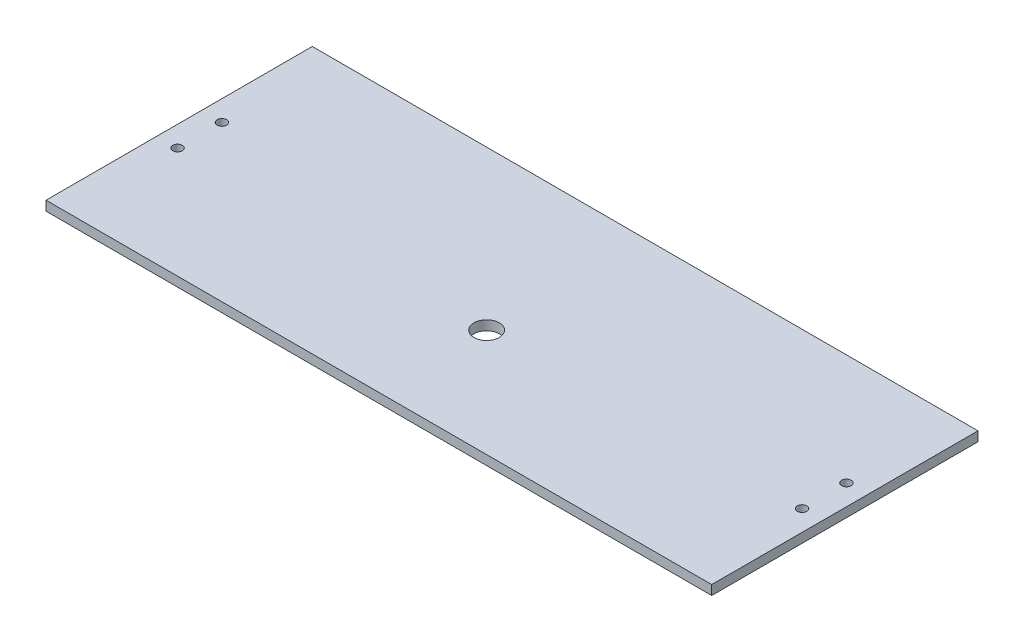
from build123d import *

# Parameters (mm, degrees)
CROQUIS2_W              = 210
CROQUIS2_H              = 84
CROQUIS2_R              = 4
CROQUIS2_R_2            = 1.5
SALIENTE_EXTRUIR1_DEPTH = 3


with BuildPart() as part:
    # Croquis2 → Saliente-Extruir1 (new body)
    with BuildSketch(Plane(origin=(-13.73192422, 703.628389678, -26.324312824), x_dir=(-1, 0, 0), z_dir=(0, -1, 0))):
        with Locations((-28.230309316, 14.115154658)):
            Rectangle(CROQUIS2_W, CROQUIS2_H)
        with Locations(Location((-28.230309316, 6.115154658, 0), (0, 0, 90))):
            Circle(CROQUIS2_R, mode=Mode.SUBTRACT)
        with Locations(Location((-126.730309316, 7.115154658, 0), (0, 0, 90))):
            Circle(CROQUIS2_R_2, mode=Mode.SUBTRACT)
        with Locations(Location((-126.730309316, 21.115154658, 0), (0, 0, 90))):
            Circle(CROQUIS2_R_2, mode=Mode.SUBTRACT)
        with Locations(Location((70.269690684, 21.115154658, 0), (0, 0, 90))):
            Circle(CROQUIS2_R_2, mode=Mode.SUBTRACT)
        with Locations(Location((70.269690684, 7.115154658, 0), (0, 0, 90))):
            Circle(CROQUIS2_R_2, mode=Mode.SUBTRACT)
    extrude(amount=-SALIENTE_EXTRUIR1_DEPTH)


solid = part.part
